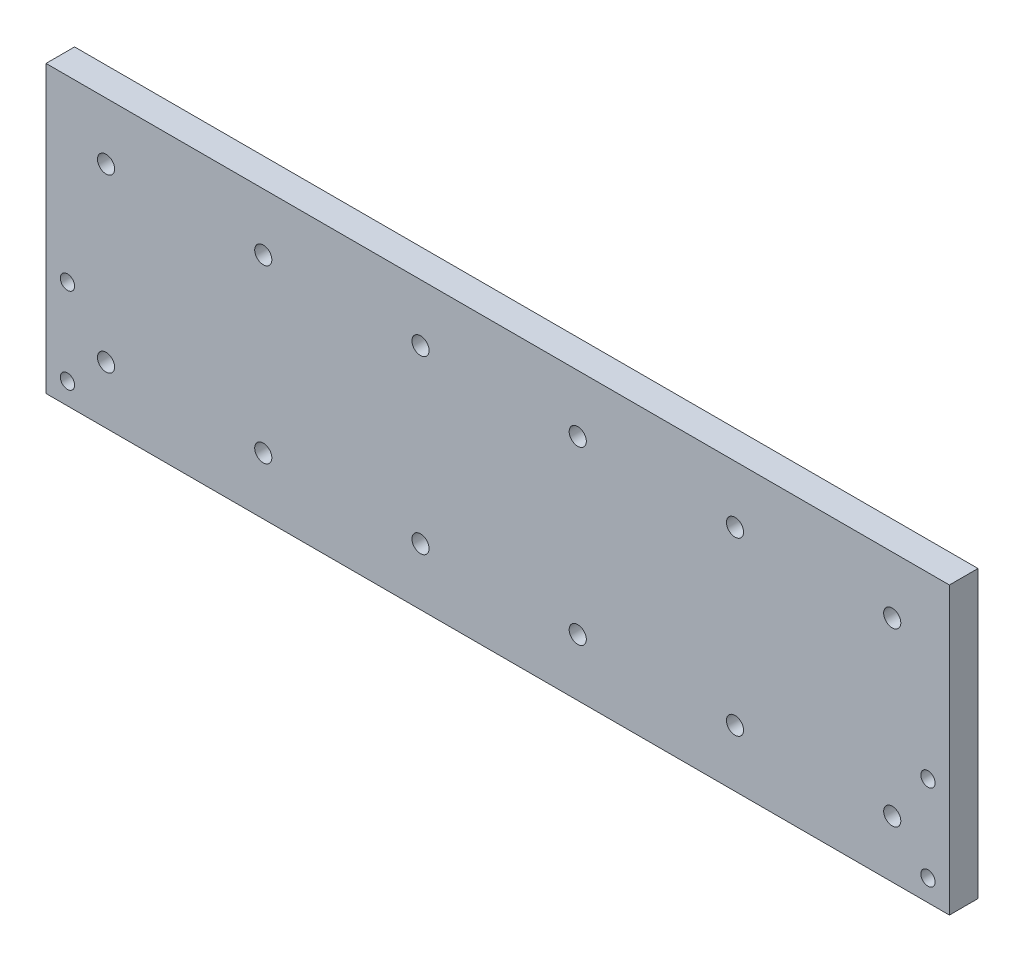
from build123d import *

# Parameters (mm, degrees)
SKETCH1_W           = 316
SKETCH1_H           = 100
BOSS_EXTRUDE1_DEPTH = 10
CUT_EXTRUDE1_REACH  = 168.024
SKETCH4_R           = 3
CUT_EXTRUDE2_REACH  = 168.024
SKETCH5_R           = 2.5
SKETCH6_R           = 4.5
CUT_EXTRUDE3_DEPTH  = 5


with BuildPart() as part:
    # Sketch1 → Boss-Extrude1 (new body)
    with BuildSketch(Plane.XY):
        Rectangle(SKETCH1_W, SKETCH1_H)
    extrude(amount=BOSS_EXTRUDE1_DEPTH)

    # Sketch4 → Cut-Extrude1 (cut, up to next)
    with BuildSketch(Plane(origin=(0, 0, 0), x_dir=(-1, 0, 0), z_dir=(0, 0, -1)), mode=Mode.PRIVATE) as cut_extrude1_sk1:
        with Locations((-138, 30)):
            Circle(SKETCH4_R)
    cut_extrude1_tool1 = extrude(cut_extrude1_sk1.sketch, amount=-CUT_EXTRUDE1_REACH, mode=Mode.PRIVATE) & part.part
    # Sketch4 → Cut-Extrude1 (cut, up to next)
    with BuildSketch(Plane(origin=(0, 0, 0), x_dir=(-1, 0, 0), z_dir=(0, 0, -1)), mode=Mode.PRIVATE) as cut_extrude1_sk2:
        with Locations((-83, 30)):
            Circle(SKETCH4_R)
    cut_extrude1_tool2 = extrude(cut_extrude1_sk2.sketch, amount=-CUT_EXTRUDE1_REACH, mode=Mode.PRIVATE) & part.part
    # Sketch4 → Cut-Extrude1 (cut, up to next)
    with BuildSketch(Plane(origin=(0, 0, 0), x_dir=(-1, 0, 0), z_dir=(0, 0, -1)), mode=Mode.PRIVATE) as cut_extrude1_sk3:
        with Locations((-28, 30)):
            Circle(SKETCH4_R)
    cut_extrude1_tool3 = extrude(cut_extrude1_sk3.sketch, amount=-CUT_EXTRUDE1_REACH, mode=Mode.PRIVATE) & part.part
    # Sketch4 → Cut-Extrude1 (cut, up to next)
    with BuildSketch(Plane(origin=(0, 0, 0), x_dir=(-1, 0, 0), z_dir=(0, 0, -1)), mode=Mode.PRIVATE) as cut_extrude1_sk4:
        with Locations((27, 30)):
            Circle(SKETCH4_R)
    cut_extrude1_tool4 = extrude(cut_extrude1_sk4.sketch, amount=-CUT_EXTRUDE1_REACH, mode=Mode.PRIVATE) & part.part
    # Sketch4 → Cut-Extrude1 (cut, up to next)
    with BuildSketch(Plane(origin=(0, 0, 0), x_dir=(-1, 0, 0), z_dir=(0, 0, -1)), mode=Mode.PRIVATE) as cut_extrude1_sk5:
        with Locations((82, 30)):
            Circle(SKETCH4_R)
    cut_extrude1_tool5 = extrude(cut_extrude1_sk5.sketch, amount=-CUT_EXTRUDE1_REACH, mode=Mode.PRIVATE) & part.part
    # Sketch4 → Cut-Extrude1 (cut, up to next)
    with BuildSketch(Plane(origin=(0, 0, 0), x_dir=(-1, 0, 0), z_dir=(0, 0, -1)), mode=Mode.PRIVATE) as cut_extrude1_sk6:
        with Locations((137, 30)):
            Circle(SKETCH4_R)
    cut_extrude1_tool6 = extrude(cut_extrude1_sk6.sketch, amount=-CUT_EXTRUDE1_REACH, mode=Mode.PRIVATE) & part.part
    # Sketch4 → Cut-Extrude1 (cut, up to next)
    with BuildSketch(Plane(origin=(0, 0, 0), x_dir=(-1, 0, 0), z_dir=(0, 0, -1)), mode=Mode.PRIVATE) as cut_extrude1_sk7:
        with Locations((137, -30)):
            Circle(SKETCH4_R)
    cut_extrude1_tool7 = extrude(cut_extrude1_sk7.sketch, amount=-CUT_EXTRUDE1_REACH, mode=Mode.PRIVATE) & part.part
    # Sketch4 → Cut-Extrude1 (cut, up to next)
    with BuildSketch(Plane(origin=(0, 0, 0), x_dir=(-1, 0, 0), z_dir=(0, 0, -1)), mode=Mode.PRIVATE) as cut_extrude1_sk8:
        with Locations((82, -30)):
            Circle(SKETCH4_R)
    cut_extrude1_tool8 = extrude(cut_extrude1_sk8.sketch, amount=-CUT_EXTRUDE1_REACH, mode=Mode.PRIVATE) & part.part
    # Sketch4 → Cut-Extrude1 (cut, up to next)
    with BuildSketch(Plane(origin=(0, 0, 0), x_dir=(-1, 0, 0), z_dir=(0, 0, -1)), mode=Mode.PRIVATE) as cut_extrude1_sk9:
        with Locations((27, -30)):
            Circle(SKETCH4_R)
    cut_extrude1_tool9 = extrude(cut_extrude1_sk9.sketch, amount=-CUT_EXTRUDE1_REACH, mode=Mode.PRIVATE) & part.part
    # Sketch4 → Cut-Extrude1 (cut, up to next)
    with BuildSketch(Plane(origin=(0, 0, 0), x_dir=(-1, 0, 0), z_dir=(0, 0, -1)), mode=Mode.PRIVATE) as cut_extrude1_sk10:
        with Locations((-28, -30)):
            Circle(SKETCH4_R)
    cut_extrude1_tool10 = extrude(cut_extrude1_sk10.sketch, amount=-CUT_EXTRUDE1_REACH, mode=Mode.PRIVATE) & part.part
    # Sketch4 → Cut-Extrude1 (cut, up to next)
    with BuildSketch(Plane(origin=(0, 0, 0), x_dir=(-1, 0, 0), z_dir=(0, 0, -1)), mode=Mode.PRIVATE) as cut_extrude1_sk11:
        with Locations((-83, -30)):
            Circle(SKETCH4_R)
    cut_extrude1_tool11 = extrude(cut_extrude1_sk11.sketch, amount=-CUT_EXTRUDE1_REACH, mode=Mode.PRIVATE) & part.part
    # Sketch4 → Cut-Extrude1 (cut, up to next)
    with BuildSketch(Plane(origin=(0, 0, 0), x_dir=(-1, 0, 0), z_dir=(0, 0, -1)), mode=Mode.PRIVATE) as cut_extrude1_sk12:
        with Locations((-138, -30)):
            Circle(SKETCH4_R)
    cut_extrude1_tool12 = extrude(cut_extrude1_sk12.sketch, amount=-CUT_EXTRUDE1_REACH, mode=Mode.PRIVATE) & part.part
    add(cut_extrude1_tool1.solids().sort_by_distance((138, 30, 0))[0], mode=Mode.SUBTRACT)
    add(cut_extrude1_tool2.solids().sort_by_distance((83, 30, 0))[0], mode=Mode.SUBTRACT)
    add(cut_extrude1_tool3.solids().sort_by_distance((28, 30, 0))[0], mode=Mode.SUBTRACT)
    add(cut_extrude1_tool4.solids().sort_by_distance((-27, 30, 0))[0], mode=Mode.SUBTRACT)
    add(cut_extrude1_tool5.solids().sort_by_distance((-82, 30, 0))[0], mode=Mode.SUBTRACT)
    add(cut_extrude1_tool6.solids().sort_by_distance((-137, 30, 0))[0], mode=Mode.SUBTRACT)
    add(cut_extrude1_tool7.solids().sort_by_distance((-137, -30, 0))[0], mode=Mode.SUBTRACT)
    add(cut_extrude1_tool8.solids().sort_by_distance((-82, -30, 0))[0], mode=Mode.SUBTRACT)
    add(cut_extrude1_tool9.solids().sort_by_distance((-27, -30, 0))[0], mode=Mode.SUBTRACT)
    add(cut_extrude1_tool10.solids().sort_by_distance((28, -30, 0))[0], mode=Mode.SUBTRACT)
    add(cut_extrude1_tool11.solids().sort_by_distance((83, -30, 0))[0], mode=Mode.SUBTRACT)
    add(cut_extrude1_tool12.solids().sort_by_distance((138, -30, 0))[0], mode=Mode.SUBTRACT)

    # Sketch5 → Cut-Extrude2 (cut, up to next)
    with BuildSketch(Plane.XY.offset(10), mode=Mode.PRIVATE) as cut_extrude2_sk1:
        with Locations((-150.5, -42.5)):
            Circle(SKETCH5_R)
    cut_extrude2_tool1 = extrude(cut_extrude2_sk1.sketch, amount=-CUT_EXTRUDE2_REACH, mode=Mode.PRIVATE) & part.part
    # Sketch5 → Cut-Extrude2 (cut, up to next)
    with BuildSketch(Plane.XY.offset(10), mode=Mode.PRIVATE) as cut_extrude2_sk2:
        with Locations((150.5, -42.5)):
            Circle(SKETCH5_R)
    cut_extrude2_tool2 = extrude(cut_extrude2_sk2.sketch, amount=-CUT_EXTRUDE2_REACH, mode=Mode.PRIVATE) & part.part
    # Sketch5 → Cut-Extrude2 (cut, up to next)
    with BuildSketch(Plane.XY.offset(10), mode=Mode.PRIVATE) as cut_extrude2_sk3:
        with Locations((-150.5, -12.5)):
            Circle(SKETCH5_R)
    cut_extrude2_tool3 = extrude(cut_extrude2_sk3.sketch, amount=-CUT_EXTRUDE2_REACH, mode=Mode.PRIVATE) & part.part
    # Sketch5 → Cut-Extrude2 (cut, up to next)
    with BuildSketch(Plane.XY.offset(10), mode=Mode.PRIVATE) as cut_extrude2_sk4:
        with Locations((150.5, -12.5)):
            Circle(SKETCH5_R)
    cut_extrude2_tool4 = extrude(cut_extrude2_sk4.sketch, amount=-CUT_EXTRUDE2_REACH, mode=Mode.PRIVATE) & part.part
    add(cut_extrude2_tool1.solids().sort_by_distance((-150.5, -42.5, 10))[0], mode=Mode.SUBTRACT)
    add(cut_extrude2_tool2.solids().sort_by_distance((150.5, -42.5, 10))[0], mode=Mode.SUBTRACT)
    add(cut_extrude2_tool3.solids().sort_by_distance((-150.5, -12.5, 10))[0], mode=Mode.SUBTRACT)
    add(cut_extrude2_tool4.solids().sort_by_distance((150.5, -12.5, 10))[0], mode=Mode.SUBTRACT)

    # Sketch6 → Cut-Extrude3 (cut)
    with BuildSketch(Plane(origin=(0, 0, 0), x_dir=(-1, 0, 0), z_dir=(0, 0, -1))):
        with Locations((-150.5, -42.5)):
            Circle(SKETCH6_R)
        with Locations((-150.5, -12.5)):
            Circle(SKETCH6_R)
        with Locations((150.5, -12.5)):
            Circle(SKETCH6_R)
        with Locations((150.5, -42.5)):
            Circle(SKETCH6_R)
    extrude(amount=-CUT_EXTRUDE3_DEPTH, mode=Mode.SUBTRACT)


solid = part.part
